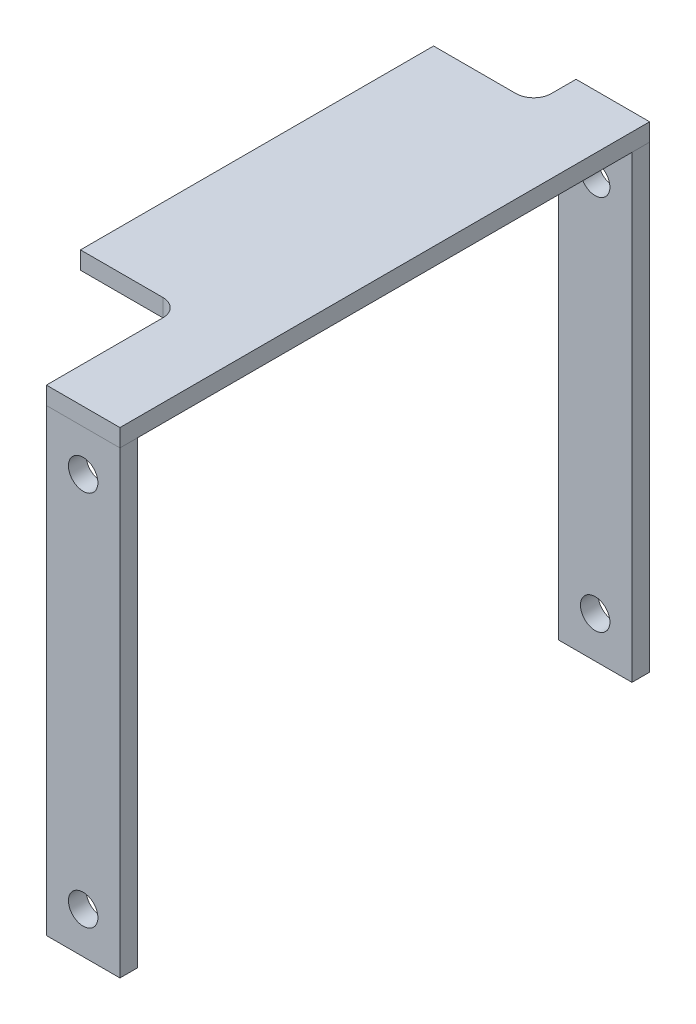
from build123d import *

# Parameters (mm, degrees)
BOSS_EXTRUDE1_DEPTH     = 12.5
CUT_EXTRUDE1_DEPTH      = 122.726127023
CUT_EXTRUDE1_DEPTH_BACK = 122.726127023
SKETCH3_R               = 2.5
SKETCH2_W               = 17
SKETCH2_H               = 60
BOSS_EXTRUDE2_DEPTH     = 3
FILLET1_R               = 3


with BuildPart() as part:
    # Sketch1 → Boss-Extrude1 (new body)
    with BuildSketch(Plane(origin=(0, 0, 0), x_dir=(0, 0, -1), z_dir=(1, 0, 0))):
        Polygon((42, 78), (-42, 78), (-42, 0), (-45, 0), (-45, 81), (45, 81), (45, 0), (42, 0), align=None)
    extrude(amount=BOSS_EXTRUDE1_DEPTH)

    # Sketch3 → Cut-Extrude1 (cut, two sides: drawn at the far end of the back side and taken through both)
    with BuildSketch(Plane.XY.offset(45).offset(-CUT_EXTRUDE1_DEPTH_BACK)):
        with Locations((6.25, 71)):
            Circle(SKETCH3_R)
        with Locations((6.25, 7)):
            Circle(SKETCH3_R)
    extrude(amount=CUT_EXTRUDE1_DEPTH + CUT_EXTRUDE1_DEPTH_BACK, mode=Mode.SUBTRACT)

    # Sketch2 → Boss-Extrude2 (add)
    with BuildSketch(Plane(origin=(0, 81, 0), x_dir=(1, 0, 0), z_dir=(0, 1, 0))):
        with Locations((-8.5, 7.794002847)):
            Rectangle(SKETCH2_W, SKETCH2_H)
    extrude(amount=-BOSS_EXTRUDE2_DEPTH)

    # Fillet1
    fillet1_edges = [part.edges().sort_by_distance(p)[0] for p in [
        (0, 79.5, -37.794002847),
        (0, 79.5, 22.205997153),
    ]]
    fillet(fillet1_edges, radius=FILLET1_R)


solid = part.part
